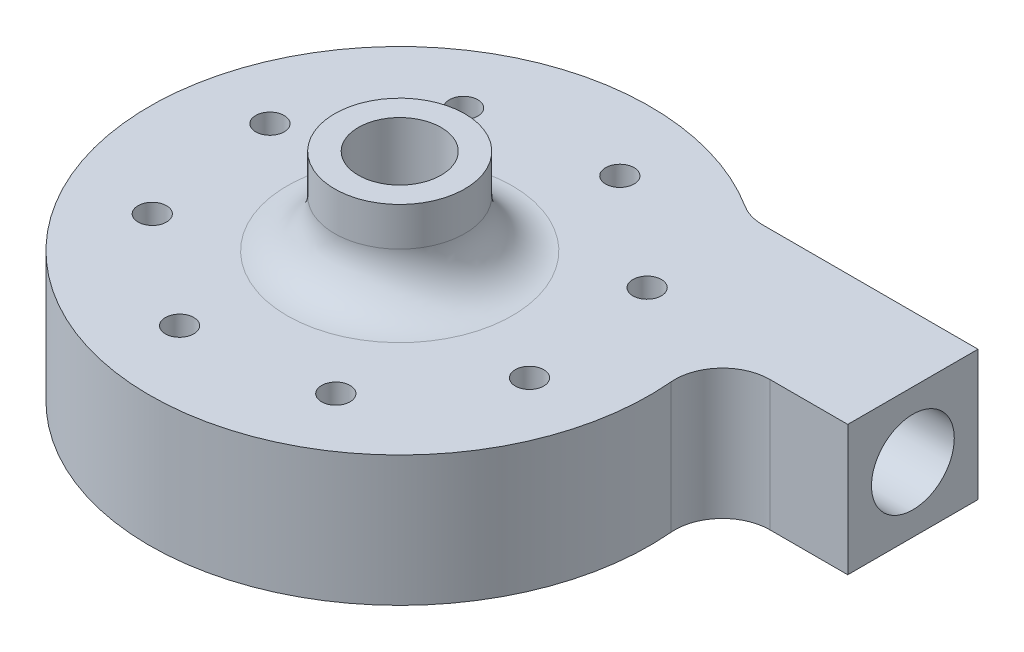
from build123d import *

# Parameters (mm, degrees)
MAIN_BODY_DEPTH   = 27.4625
SKETCH5_R         = 3
BOLTS_DEPTH       = 40
CIRPATTERN1_COUNT = 8


with BuildPart() as part:
    # Sketch1 → main body (new body)
    with BuildSketch(Plane(origin=(0, 0, 0), x_dir=(1, 0, 0), z_dir=(0, 1, 0))):
        with BuildLine():
            Line((78.940920787, 29.260248187), (78.940920787, 42.991498187))
            Line((78.940920787, 42.991498187), (33.607493508, 42.991498187))
            ThreePointArc((33.607493508, 42.991498187), (30.818999532, 43.388149742), (28.251717651, 44.546637918))
            ThreePointArc((28.251717651, 44.546637918), (-45.055503459, -27.432901926), (52.544834991, 4.647882938))
            ThreePointArc((52.544834991, 4.647882938), (55.129927576, 12.281362495), (62.50594115, 15.528998187))
            Line((62.50594115, 15.528998187), (78.940920787, 15.528998187))
            Line((78.940920787, 15.528998187), (78.940920787, 29.260248187))
        make_face()
    extrude(amount=MAIN_BODY_DEPTH)

    # Sketch2 → main chamber (revolve, cut)
    with BuildSketch(Plane.XY, mode=Mode.PRIVATE) as main_chamber_sk:
        Polygon((0, 27.4625), (5.4102, 27.4625), (5.4102, 20.622990129), (30.626685, 14.099501692), (30.626685, 13.73125), (30.626685, 0), (0, 0), align=None)
    revolve(main_chamber_sk.sketch.rotate(Axis((0, 0, 0), (0, 1, 0)), 90), axis=Axis((0, 0, 0), (0, 1, 0)), mode=Mode.SUBTRACT)

    # Sketch4 → inlet (revolve)
    with BuildSketch(Plane.XY, mode=Mode.PRIVATE) as inlet_sk:
        with BuildLine():
            Line((5.4102, 27.4625), (5.4102, 30.622990129))
            Line((5.4102, 30.622990129), (8.73125, 30.622990129))
            Line((8.73125, 30.622990129), (8.73125, 45.622990129))
            Line((8.73125, 45.622990129), (13.73125, 45.622990129))
            Line((13.73125, 45.622990129), (13.73125, 37.4625))
            ThreePointArc((13.73125, 37.4625), (16.660182188, 30.391432188), (23.73125, 27.4625))
            Line((23.73125, 27.4625), (5.4102, 27.4625))
        make_face()
    revolve(inlet_sk.sketch.rotate(Axis((0, 0, 0), (0, 1, 0)), 90), axis=Axis((0, 0, 0), (0, 1, 0)))

    # Sketch3 → expansion cone and outlet (revolve, cut)
    with BuildSketch(Plane(origin=(0, 13.73125, 0), x_dir=(1, 0, 0), z_dir=(0, 1, 0))):
        Polygon((2.669291479, 30.510141217), (60.940920787, 35.608248187), (60.940920787, 37.991498187), (78.940920787, 37.991498187), (78.940920787, 29.260248187), (60.940920787, 29.260248187), (2.559940008, 29.260248187), align=None)
    revolve(axis=Axis((60.940920787, 13.73125, -29.260248187), (-1, 0, 0)), mode=Mode.SUBTRACT)

    # Sketch5 → bolts (cut)
    with BuildSketch(Plane(origin=(0, 27.4625, 0), x_dir=(1, 0, 0), z_dir=(0, 1, 0))):
        with Locations(Location((32.820818094, 19.349519364, 0), (0, 0, 270))):
            Circle(SKETCH5_R)
    bolts = extrude(amount=-BOLTS_DEPTH, mode=Mode.SUBTRACT)

    # CirPattern1: bolts ×8 about axis
    cirpattern1_axis = Axis((0, 0, 0), (0, 1, 0))
    for i in range(1, CIRPATTERN1_COUNT):
        add(bolts.rotate(cirpattern1_axis, i * 360 / CIRPATTERN1_COUNT), mode=Mode.SUBTRACT)


solid = part.part
